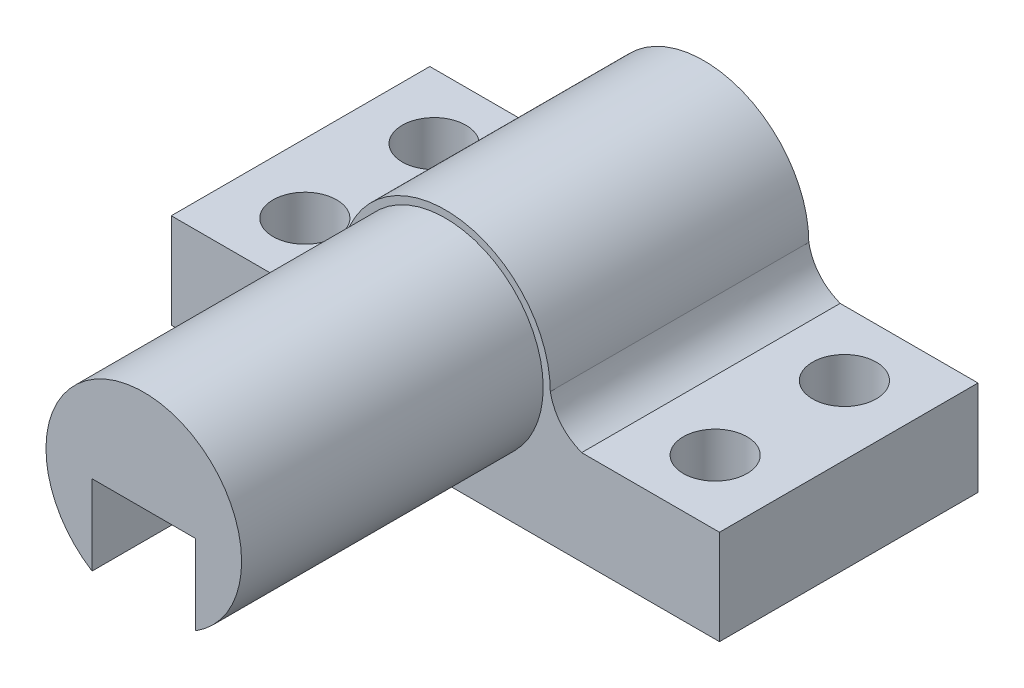
from build123d import *

# Parameters (mm, degrees)
BOSS_EXTRUDE1_DEPTH = 30
SKETCH2_R           = 11.35
BOSS_EXTRUDE2_DEPTH = 35
SKETCH3_R           = 3.7
CUT_EXTRUDE1_DEPTH  = 75.22257831
CUT_EXTRUDE2_DEPTH  = 28


with BuildPart() as part:
    # Sketch1 → Boss-Extrude1 (new body)
    with BuildSketch(Plane.XY):
        with BuildLine():
            Line((-31.808576883, -15.32365322), (31.808576883, -15.32365322))
            Line((31.808576883, -15.32365322), (31.808576883, -4.32365322))
            Line((31.808576883, -4.32365322), (15.808576883, -4.32365322))
            add(Edge.make_bspline(
                [(12.175, 0), (12.801032904, -3.083922052), (15.808576883, -4.32365322)],
                knots=[0, 0, 0, 1, 1, 1], degree=2))
            ThreePointArc((12.175, 0), (0, 12.175), (-12.175, 0))
            add(Edge.make_bspline(
                [(-12.175, 0), (-12.801032904, -3.083922052), (-15.808576883, -4.32365322)],
                knots=[0, 0, 0, 1, 1, 1], degree=2))
            Line((-15.808576883, -4.32365322), (-31.808576883, -4.32365322))
            Line((-31.808576883, -4.32365322), (-31.808576883, -15.32365322))
        make_face()
    extrude(amount=BOSS_EXTRUDE1_DEPTH)

    # Sketch2 → Boss-Extrude2 (add)
    with BuildSketch(Plane.XY.offset(30)):
        Circle(SKETCH2_R)
    extrude(amount=BOSS_EXTRUDE2_DEPTH)

    # Sketch3 → Cut-Extrude1 (cut, through all)
    with BuildSketch(Plane(origin=(0, -4.32365322, 0), x_dir=(1, 0, 0), z_dir=(0, 1, 0))):
        with Locations(Location((-23.808576883, -7.5, 0), (0, 0, 270))):
            Circle(SKETCH3_R)
        with Locations(Location((-23.808576883, -22.5, 0), (0, 0, 90))):
            Circle(SKETCH3_R)
        with Locations(Location((23.808576883, -22.5, 0), (0, 0, 270))):
            Circle(SKETCH3_R)
        with Locations(Location((23.808576883, -7.5, 0), (0, 0, 90))):
            Circle(SKETCH3_R)
    extrude(amount=-CUT_EXTRUDE1_DEPTH, mode=Mode.SUBTRACT)

    # Sketch5 → Cut-Extrude2 (cut)
    with BuildSketch(Plane.XY.offset(65)):
        Polygon((-3.75, -11.35), (3.75, -11.35), (6, -11.35), (6, -0.35), (-6, -0.35), (-6, -11.35), align=None)
    extrude(amount=-CUT_EXTRUDE2_DEPTH, mode=Mode.SUBTRACT)


solid = part.part
